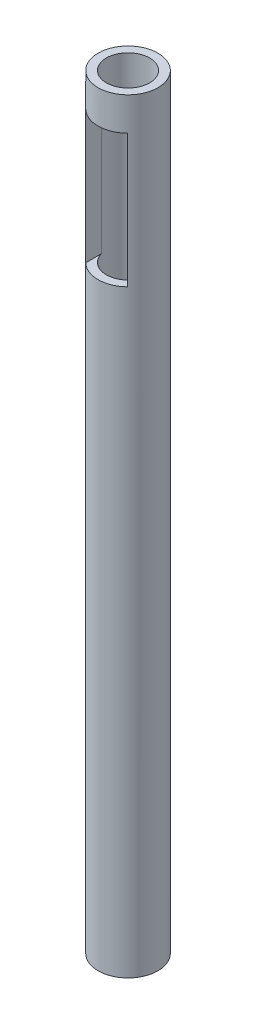
from build123d import *

# Parameters (mm, degrees)
SKETCH1_R           = 18
SKETCH1_R_2         = 13
BOSS_EXTRUDE1_DEPTH = 225
SKETCH8_R           = 18
BOSS_EXTRUDE3_DEPTH = 10
SKETCH9_R           = 12.55
CUT_EXTRUDE2_DEPTH  = 899.5
SKETCH23_W          = 25
SKETCH23_H          = 80
CUT_EXTRUDE16_DEPTH = 30


with BuildPart() as part:
    # Sketch1 → Boss-Extrude1 (new, symmetric)
    with BuildSketch(Plane(origin=(0, 0, 0), x_dir=(1, 0, 0), z_dir=(0, 1, 0))):
        Circle(SKETCH1_R)
        Circle(SKETCH1_R_2, mode=Mode.SUBTRACT)
    extrude(amount=BOSS_EXTRUDE1_DEPTH, both=True)

    # Sketch8 → Boss-Extrude3 (add)
    with BuildSketch(Plane.XZ.offset(225)):
        Circle(SKETCH8_R)
    extrude(amount=BOSS_EXTRUDE3_DEPTH)

    # Sketch9 → Cut-Extrude2 (cut)
    with BuildSketch(Plane(origin=(-32.302786122, 416.289190775, -45.221901395), x_dir=(-0.9768887275019512, 0, 0.2137484832217963), z_dir=(0, 1, 0))):
        with Locations((-21.890114798, 51.081437247)):
            Circle(SKETCH9_R)
    extrude(amount=-CUT_EXTRUDE2_DEPTH, mode=Mode.SUBTRACT)

    # Sketch23 → Cut-Extrude16 (cut)
    with BuildSketch(Plane.XY):
        with Locations((0, 165)):
            Rectangle(SKETCH23_W, SKETCH23_H)
    extrude(amount=CUT_EXTRUDE16_DEPTH, mode=Mode.SUBTRACT)


solid = part.part
